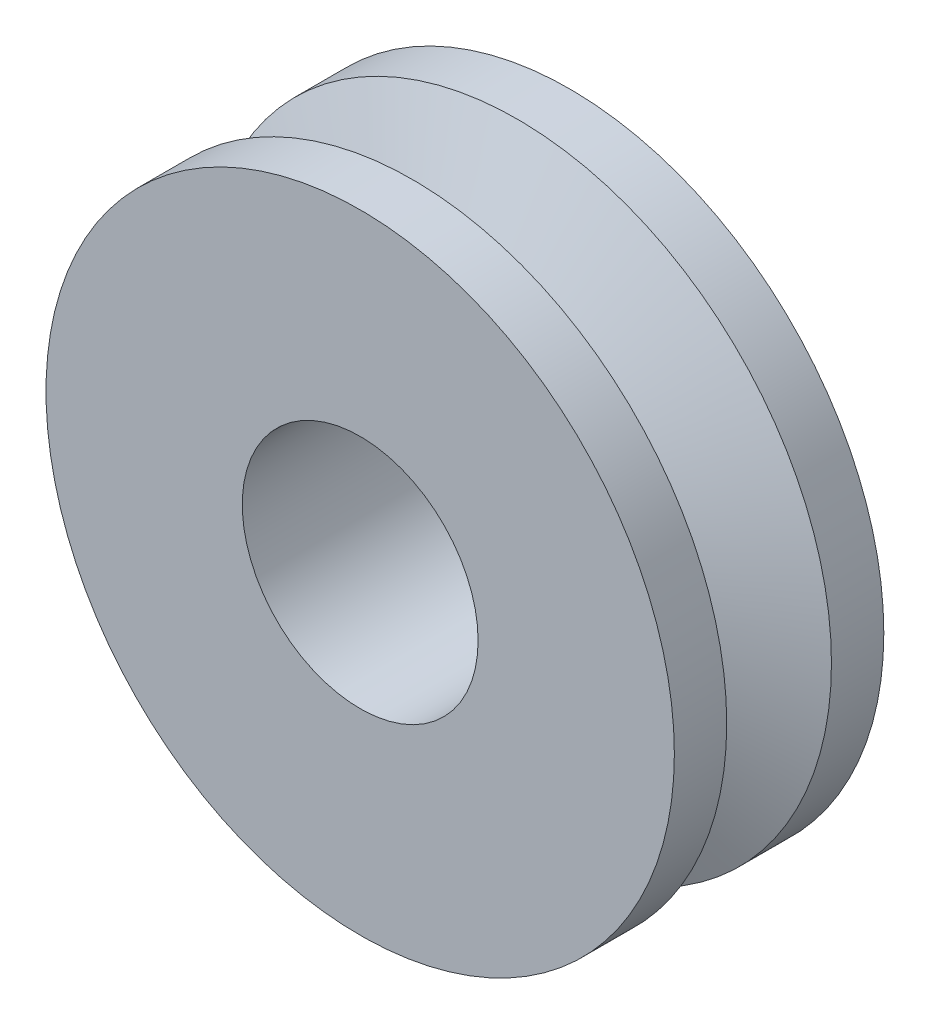
from build123d import *


with BuildPart() as part:
    # Çizim1 → Döndür1 (revolve)
    with BuildSketch(Plane(origin=(0, 0, 0), x_dir=(0, 0, -1), z_dir=(1, 0, 0)), mode=Mode.PRIVATE) as d_nd_r1_sk:
        Polygon((-2.5, 15), (0, 8.964466094), (2.5, 15), (5, 15), (5, 5.63), (-5, 5.63), (-5, 15), align=None)
    revolve(d_nd_r1_sk.sketch.rotate(Axis((0, 0, 13.198807947), (0, 0, -1)), 90), axis=Axis((0, 0, 13.198807947), (0, 0, -1)))


solid = part.part
